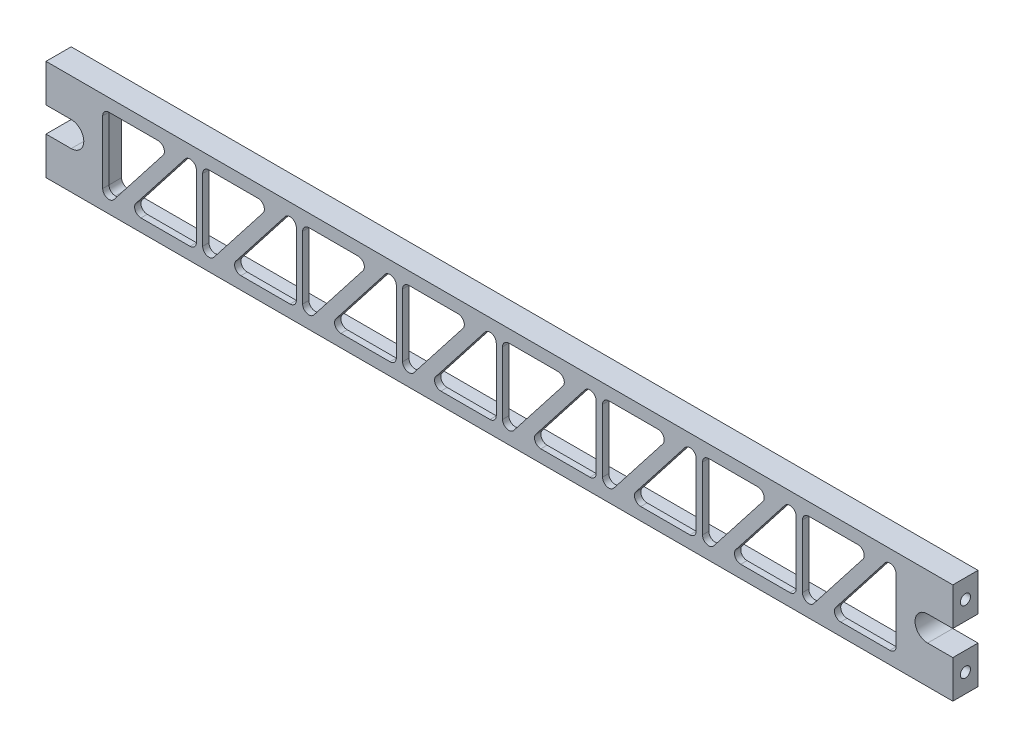
from build123d import *

# Parameters (mm, degrees)
SKETCH1_W                             = 12.7
SKETCH1_H                             = 50.8
BOSS_EXTRUDE1_DEPTH                   = 228.6
F_1_4_20_TAPPED_HOLE1_D               = 5.1054
F_1_4_20_TAPPED_HOLE1_DEPTH           = 19.05
F_1_4_20_TAPPED_HOLE1_TIP             = 1.533816902
F_1_4_20_TAPPED_HOLE1_ON_FACE_2_D     = 5.1054
F_1_4_20_TAPPED_HOLE1_ON_FACE_2_DEPTH = 19.05
F_1_4_20_TAPPED_HOLE1_ON_FACE_2_TIP   = 1.533816902
CUT_EXTRUDE1_DEPTH                    = 9.525
CUT_EXTRUDE2_DEPTH                    = 235.370061281
CUT_EXTRUDE3_DEPTH                    = 235.52055347


with BuildPart() as part:
    # Sketch1 → Boss-Extrude1 (new, symmetric)
    with BuildSketch(Plane(origin=(0, 0, 0), x_dir=(0, 0, -1), z_dir=(1, 0, 0))):
        with Locations((6.35, 25.4)):
            Rectangle(SKETCH1_W, SKETCH1_H)
    extrude(amount=BOSS_EXTRUDE1_DEPTH, both=True)

    # 1/4-20 Tapped Hole1
    with Locations(Plane(origin=(228.6, 41.275, -6.35), x_dir=(0, 0, 1), z_dir=(1, 0, 0))):
        with Locations((0, 0), (0, 31.75)):
            Hole(F_1_4_20_TAPPED_HOLE1_D / 2, depth=F_1_4_20_TAPPED_HOLE1_DEPTH)
            with Locations((0, 0, -(F_1_4_20_TAPPED_HOLE1_DEPTH + F_1_4_20_TAPPED_HOLE1_TIP / 2))):  # 118° drill point
                Cone(0, F_1_4_20_TAPPED_HOLE1_D / 2, F_1_4_20_TAPPED_HOLE1_TIP, mode=Mode.SUBTRACT)

    # 1/4-20 Tapped Hole1 on face 2
    with Locations(Plane(origin=(-228.6, 9.525, -6.35), x_dir=(0, 0, -1), z_dir=(-1, 0, 0))):
        with Locations((0, 0), (0, -31.75)):
            Hole(F_1_4_20_TAPPED_HOLE1_ON_FACE_2_D / 2, depth=F_1_4_20_TAPPED_HOLE1_ON_FACE_2_DEPTH)
            with Locations((0, 0, -(F_1_4_20_TAPPED_HOLE1_ON_FACE_2_DEPTH + F_1_4_20_TAPPED_HOLE1_ON_FACE_2_TIP / 2))):  # 118° drill point
                Cone(0, F_1_4_20_TAPPED_HOLE1_ON_FACE_2_D / 2, F_1_4_20_TAPPED_HOLE1_ON_FACE_2_TIP, mode=Mode.SUBTRACT)

    # Sketch4 → Cut-Extrude1 (cut)
    with BuildSketch(Plane(origin=(0, 0, -12.7), x_dir=(-1, 0, 0), z_dir=(0, 0, -1))):
        with BuildLine():
            Line((200.025, 47.625), (-200.025, 47.625))
            ThreePointArc((-200.025, 47.625), (-202.27006403, 46.69506403), (-203.2, 44.45))
            Line((-203.2, 44.45), (-203.2, 6.35))
            ThreePointArc((-203.2, 6.35), (-202.27006403, 4.10493597), (-200.025, 3.175))
            Line((-200.025, 3.175), (200.025, 3.175))
            ThreePointArc((200.025, 3.175), (202.27006403, 4.10493597), (203.2, 6.35))
            Line((203.2, 6.35), (203.2, 44.45))
            ThreePointArc((203.2, 44.45), (202.27006403, 46.69506403), (200.025, 47.625))
        make_face()
    extrude(amount=-CUT_EXTRUDE1_DEPTH, mode=Mode.SUBTRACT)

    # Sketch5 → Cut-Extrude2 (cut, through all)
    with BuildSketch(Plane(origin=(0, 0, -3.175), x_dir=(-1, 0, 0), z_dir=(0, 0, -1))):
        with BuildLine():
            Line((-200.025, 41.275), (-200.025, 9.525))
            ThreePointArc((-200.025, 9.525), (-199.09506403, 7.27993597), (-196.85, 6.35))
            Line((-196.85, 6.35), (-172.079670497, 6.35))
            ThreePointArc((-172.079670497, 6.35), (-169.226482862, 8.132180803), (-169.576379466, 11.477987203))
            Line((-169.576379466, 11.477987203), (-194.346708969, 43.227987203))
            ThreePointArc((-194.346708969, 43.227987203), (-197.882636426, 44.277380224), (-200.025, 41.275))
        make_face()
        with BuildLine():
            Line((-183.245495534, 39.322012797), (-158.475166031, 7.572012797))
            ThreePointArc((-158.475166031, 7.572012797), (-154.939238574, 6.522619776), (-152.796875, 9.525))
            Line((-152.796875, 9.525), (-152.796875, 41.275))
            ThreePointArc((-152.796875, 41.275), (-153.72681097, 43.52006403), (-155.971875, 44.45))
            Line((-155.971875, 44.45), (-180.742204503, 44.45))
            ThreePointArc((-180.742204503, 44.45), (-183.595392138, 42.667819197), (-183.245495534, 39.322012797))
        make_face()
        with BuildLine():
            Line((-149.621875, 41.275), (-149.621875, 9.525))
            ThreePointArc((-149.621875, 9.525), (-148.69193903, 7.27993597), (-146.446875, 6.35))
            Line((-146.446875, 6.35), (-121.676545497, 6.35))
            ThreePointArc((-121.676545497, 6.35), (-118.823357862, 8.132180803), (-119.173254466, 11.477987203))
            Line((-119.173254466, 11.477987203), (-143.943583969, 43.227987203))
            ThreePointArc((-143.943583969, 43.227987203), (-147.479511426, 44.277380224), (-149.621875, 41.275))
        make_face()
        with BuildLine():
            Line((-132.842370534, 39.322012797), (-108.072041031, 7.572012797))
            ThreePointArc((-108.072041031, 7.572012797), (-104.536113574, 6.522619776), (-102.39375, 9.525))
            Line((-102.39375, 9.525), (-102.39375, 41.275))
            ThreePointArc((-102.39375, 41.275), (-103.32368597, 43.52006403), (-105.56875, 44.45))
            Line((-105.56875, 44.45), (-130.339079503, 44.45))
            ThreePointArc((-130.339079503, 44.45), (-133.192267138, 42.667819197), (-132.842370534, 39.322012797))
        make_face()
        with BuildLine():
            Line((-99.21875, 41.275), (-99.21875, 9.525))
            ThreePointArc((-99.21875, 9.525), (-98.28881403, 7.27993597), (-96.04375, 6.35))
            Line((-96.04375, 6.35), (-71.273420497, 6.35))
            ThreePointArc((-71.273420497, 6.35), (-68.420232862, 8.132180803), (-68.770129466, 11.477987203))
            Line((-68.770129466, 11.477987203), (-93.540458969, 43.227987203))
            ThreePointArc((-93.540458969, 43.227987203), (-97.076386426, 44.277380224), (-99.21875, 41.275))
        make_face()
        with BuildLine():
            Line((-82.439245534, 39.322012797), (-57.668916031, 7.572012797))
            ThreePointArc((-57.668916031, 7.572012797), (-54.132988574, 6.522619776), (-51.990625, 9.525))
            Line((-51.990625, 9.525), (-51.990625, 41.275))
            ThreePointArc((-51.990625, 41.275), (-52.92056097, 43.52006403), (-55.165625, 44.45))
            Line((-55.165625, 44.45), (-79.935954503, 44.45))
            ThreePointArc((-79.935954503, 44.45), (-82.789142138, 42.667819197), (-82.439245534, 39.322012797))
        make_face()
        with BuildLine():
            Line((-48.815625, 41.275), (-48.815625, 9.525))
            ThreePointArc((-48.815625, 9.525), (-47.88568903, 7.27993597), (-45.640625, 6.35))
            Line((-45.640625, 6.35), (-20.870295497, 6.35))
            ThreePointArc((-20.870295497, 6.35), (-18.017107862, 8.132180803), (-18.367004466, 11.477987203))
            Line((-18.367004466, 11.477987203), (-43.137333969, 43.227987203))
            ThreePointArc((-43.137333969, 43.227987203), (-46.673261426, 44.277380224), (-48.815625, 41.275))
        make_face()
        with BuildLine():
            Line((-32.036120534, 39.322012797), (-7.265791031, 7.572012797))
            ThreePointArc((-7.265791031, 7.572012797), (-3.729863574, 6.522619776), (-1.5875, 9.525))
            Line((-1.5875, 9.525), (-1.5875, 41.275))
            ThreePointArc((-1.5875, 41.275), (-2.51743597, 43.52006403), (-4.7625, 44.45))
            Line((-4.7625, 44.45), (-29.532829503, 44.45))
            ThreePointArc((-29.532829503, 44.45), (-32.386017138, 42.667819197), (-32.036120534, 39.322012797))
        make_face()
        with BuildLine():
            Line((1.5875, 41.275), (1.5875, 9.525))
            ThreePointArc((1.5875, 9.525), (2.51743597, 7.27993597), (4.7625, 6.35))
            Line((4.7625, 6.35), (29.532829503, 6.35))
            ThreePointArc((29.532829503, 6.35), (32.386017138, 8.132180803), (32.036120534, 11.477987203))
            Line((32.036120534, 11.477987203), (7.265791031, 43.227987203))
            ThreePointArc((7.265791031, 43.227987203), (3.729863574, 44.277380224), (1.5875, 41.275))
        make_face()
        with BuildLine():
            Line((18.367004466, 39.322012797), (43.137333969, 7.572012797))
            ThreePointArc((43.137333969, 7.572012797), (46.673261426, 6.522619776), (48.815625, 9.525))
            Line((48.815625, 9.525), (48.815625, 41.275))
            ThreePointArc((48.815625, 41.275), (47.88568903, 43.52006403), (45.640625, 44.45))
            Line((45.640625, 44.45), (20.870295497, 44.45))
            ThreePointArc((20.870295497, 44.45), (18.017107862, 42.667819197), (18.367004466, 39.322012797))
        make_face()
        with BuildLine():
            Line((51.990625, 41.275), (51.990625, 9.525))
            ThreePointArc((51.990625, 9.525), (52.92056097, 7.27993597), (55.165625, 6.35))
            Line((55.165625, 6.35), (79.935954503, 6.35))
            ThreePointArc((79.935954503, 6.35), (82.789142138, 8.132180803), (82.439245534, 11.477987203))
            Line((82.439245534, 11.477987203), (57.668916031, 43.227987203))
            ThreePointArc((57.668916031, 43.227987203), (54.132988574, 44.277380224), (51.990625, 41.275))
        make_face()
        with BuildLine():
            Line((68.770129466, 39.322012797), (93.540458969, 7.572012797))
            ThreePointArc((93.540458969, 7.572012797), (97.076386426, 6.522619776), (99.21875, 9.525))
            Line((99.21875, 9.525), (99.21875, 41.275))
            ThreePointArc((99.21875, 41.275), (98.28881403, 43.52006403), (96.04375, 44.45))
            Line((96.04375, 44.45), (71.273420497, 44.45))
            ThreePointArc((71.273420497, 44.45), (68.420232862, 42.667819197), (68.770129466, 39.322012797))
        make_face()
        with BuildLine():
            Line((102.39375, 41.275), (102.39375, 9.525))
            ThreePointArc((102.39375, 9.525), (103.32368597, 7.27993597), (105.56875, 6.35))
            Line((105.56875, 6.35), (130.339079503, 6.35))
            ThreePointArc((130.339079503, 6.35), (133.192267138, 8.132180803), (132.842370534, 11.477987203))
            Line((132.842370534, 11.477987203), (108.072041031, 43.227987203))
            ThreePointArc((108.072041031, 43.227987203), (104.536113574, 44.277380224), (102.39375, 41.275))
        make_face()
        with BuildLine():
            Line((119.173254466, 39.322012797), (143.943583969, 7.572012797))
            ThreePointArc((143.943583969, 7.572012797), (147.479511426, 6.522619776), (149.621875, 9.525))
            Line((149.621875, 9.525), (149.621875, 41.275))
            ThreePointArc((149.621875, 41.275), (148.69193903, 43.52006403), (146.446875, 44.45))
            Line((146.446875, 44.45), (121.676545497, 44.45))
            ThreePointArc((121.676545497, 44.45), (118.823357862, 42.667819197), (119.173254466, 39.322012797))
        make_face()
        with BuildLine():
            Line((152.796875, 41.275), (152.796875, 9.525))
            ThreePointArc((152.796875, 9.525), (153.72681097, 7.27993597), (155.971875, 6.35))
            Line((155.971875, 6.35), (180.742204503, 6.35))
            ThreePointArc((180.742204503, 6.35), (183.595392138, 8.132180803), (183.245495534, 11.477987203))
            Line((183.245495534, 11.477987203), (158.475166031, 43.227987203))
            ThreePointArc((158.475166031, 43.227987203), (154.939238574, 44.277380224), (152.796875, 41.275))
        make_face()
        with BuildLine():
            Line((169.576379466, 39.322012797), (194.346708969, 7.572012797))
            ThreePointArc((194.346708969, 7.572012797), (197.882636426, 6.522619776), (200.025, 9.525))
            Line((200.025, 9.525), (200.025, 41.275))
            ThreePointArc((200.025, 41.275), (199.09506403, 43.52006403), (196.85, 44.45))
            Line((196.85, 44.45), (172.079670497, 44.45))
            ThreePointArc((172.079670497, 44.45), (169.226482862, 42.667819197), (169.576379466, 39.322012797))
        make_face()
    extrude(amount=-CUT_EXTRUDE2_DEPTH, mode=Mode.SUBTRACT)

    # Sketch6 → Cut-Extrude3 (cut, through all)
    with BuildSketch(Plane.XY):
        with BuildLine():
            Line((-215.9, 31.75), (-228.6, 31.75))
            Line((-228.6, 31.75), (-228.6, 19.05))
            Line((-228.6, 19.05), (-215.9, 19.05))
            ThreePointArc((-215.9, 19.05), (-209.55, 25.4), (-215.9, 31.75))
        make_face()
        with BuildLine():
            Line((228.6, 19.05), (215.9, 19.05))
            ThreePointArc((215.9, 19.05), (209.55, 25.4), (215.9, 31.75))
            Line((215.9, 31.75), (228.6, 31.75))
            Line((228.6, 31.75), (228.6, 19.05))
        make_face()
    extrude(amount=-CUT_EXTRUDE3_DEPTH, mode=Mode.SUBTRACT)


solid = part.part
